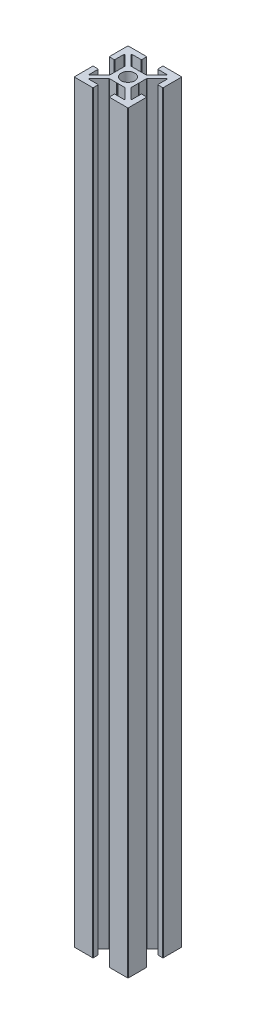
from build123d import *

# Parameters (mm, degrees)
SKETCH1_R           = 2.5
BOSS_EXTRUDE1_DEPTH = 280


with BuildPart() as part:
    # Sketch1 → Boss-Extrude1 (new body)
    with BuildSketch(Plane(origin=(0, 0, 0), x_dir=(1, 0, 0), z_dir=(0, 1, 0))):
        with BuildLine():
            Line((-2.997918472, 4.058578644), (-6.597918472, 7.658578644))
            ThreePointArc((-6.597918472, 7.658578644), (-6.621415508, 7.686854412), (-6.639339828, 7.718953455))
            ThreePointArc((-6.639339828, 7.718953455), (-6.656497116, 7.8), (-6.639339828, 7.881046545))
            ThreePointArc((-6.639339828, 7.881046545), (-6.565562901, 7.967644429), (-6.456497116, 8))
            Line((-6.456497116, 8), (-3.2, 8))
            ThreePointArc((-3.2, 8), (-3.058578644, 8.058578644), (-3, 8.2))
            Line((-3, 8.2), (-3, 9.8))
            ThreePointArc((-3, 9.8), (-3.058578644, 9.941421356), (-3.2, 10))
            Line((-3.2, 10), (-9.8, 10))
            ThreePointArc((-9.8, 10), (-9.941421356, 9.941421356), (-10, 9.8))
            Line((-10, 9.8), (-10, 3.2))
            ThreePointArc((-10, 3.2), (-9.941421356, 3.058578644), (-9.8, 3))
            Line((-9.8, 3), (-8.2, 3))
            ThreePointArc((-8.2, 3), (-8.058578644, 3.058578644), (-8, 3.2))
            Line((-8, 3.2), (-8, 6.456497116))
            ThreePointArc((-8, 6.456497116), (-7.967644429, 6.565562901), (-7.881046545, 6.639339828))
            ThreePointArc((-7.881046545, 6.639339828), (-7.8, 6.656497116), (-7.718953455, 6.639339828))
            ThreePointArc((-7.718953455, 6.639339828), (-7.686854412, 6.621415508), (-7.658578644, 6.597918472))
            Line((-7.658578644, 6.597918472), (-4.058578644, 2.997918472))
            ThreePointArc((-4.058578644, 2.997918472), (-4.015224093, 2.933033802), (-4, 2.856497116))
            Line((-4, 2.856497116), (-4, 0.130901699))
            ThreePointArc((-4, 0.130901699), (-3.99253254, 0.104615144), (-3.97236068, 0.08618034))
            Line((-3.97236068, 0.08618034), (-3.8, 0))
            Line((-3.8, 0), (-3.97236068, -0.08618034))
            ThreePointArc((-3.97236068, -0.08618034), (-3.99253254, -0.104615144), (-4, -0.130901699))
            Line((-4, -0.130901699), (-4, -2.856497116))
            ThreePointArc((-4, -2.856497116), (-4.015224093, -2.933033802), (-4.058578644, -2.997918472))
            Line((-4.058578644, -2.997918472), (-7.658578644, -6.597918472))
            ThreePointArc((-7.658578644, -6.597918472), (-7.686854412, -6.621415508), (-7.718953455, -6.639339828))
            ThreePointArc((-7.718953455, -6.639339828), (-7.8, -6.656497116), (-7.881046545, -6.639339828))
            ThreePointArc((-7.881046545, -6.639339828), (-7.967644429, -6.565562901), (-8, -6.456497116))
            Line((-8, -6.456497116), (-8, -3.2))
            ThreePointArc((-8, -3.2), (-8.058578644, -3.058578644), (-8.2, -3))
            Line((-8.2, -3), (-9.8, -3))
            ThreePointArc((-9.8, -3), (-9.941421356, -3.058578644), (-10, -3.2))
            Line((-10, -3.2), (-10, -9.8))
            ThreePointArc((-10, -9.8), (-9.941421356, -9.941421356), (-9.8, -10))
            Line((-9.8, -10), (-3.2, -10))
            ThreePointArc((-3.2, -10), (-3.058578644, -9.941421356), (-3, -9.8))
            Line((-3, -9.8), (-3, -8.2))
            ThreePointArc((-3, -8.2), (-3.058578644, -8.058578644), (-3.2, -8))
            Line((-3.2, -8), (-6.456497116, -8))
            ThreePointArc((-6.456497116, -8), (-6.565562901, -7.967644429), (-6.639339828, -7.881046545))
            ThreePointArc((-6.639339828, -7.881046545), (-6.656497116, -7.8), (-6.639339828, -7.718953455))
            ThreePointArc((-6.639339828, -7.718953455), (-6.621415508, -7.686854412), (-6.597918472, -7.658578644))
            Line((-6.597918472, -7.658578644), (-2.997918472, -4.058578644))
            ThreePointArc((-2.997918472, -4.058578644), (-2.933033802, -4.015224093), (-2.856497116, -4))
            Line((-2.856497116, -4), (-0.211803399, -4))
            ThreePointArc((-0.211803399, -4), (-0.200315753, -3.998662449), (-0.189442719, -3.99472136))
            Line((-0.189442719, -3.99472136), (0, -3.9))
            Line((0, -3.9), (0.189442719, -3.99472136))
            ThreePointArc((0.189442719, -3.99472136), (0.200315753, -3.998662449), (0.211803399, -4))
            Line((0.211803399, -4), (2.856497116, -4))
            ThreePointArc((2.856497116, -4), (2.933033802, -4.015224093), (2.997918472, -4.058578644))
            Line((2.997918472, -4.058578644), (6.597918472, -7.658578644))
            ThreePointArc((6.597918472, -7.658578644), (6.621415508, -7.686854412), (6.639339828, -7.718953455))
            ThreePointArc((6.639339828, -7.718953455), (6.656497116, -7.8), (6.639339828, -7.881046545))
            ThreePointArc((6.639339828, -7.881046545), (6.565562901, -7.967644429), (6.456497116, -8))
            Line((6.456497116, -8), (3.2, -8))
            ThreePointArc((3.2, -8), (3.058578644, -8.058578644), (3, -8.2))
            Line((3, -8.2), (3, -9.8))
            ThreePointArc((3, -9.8), (3.058578644, -9.941421356), (3.2, -10))
            Line((3.2, -10), (9.8, -10))
            ThreePointArc((9.8, -10), (9.941421356, -9.941421356), (10, -9.8))
            Line((10, -9.8), (10, -3.2))
            ThreePointArc((10, -3.2), (9.941421356, -3.058578644), (9.8, -3))
            Line((9.8, -3), (8.2, -3))
            ThreePointArc((8.2, -3), (8.058578644, -3.058578644), (8, -3.2))
            Line((8, -3.2), (8, -6.456497116))
            ThreePointArc((8, -6.456497116), (7.967644429, -6.565562901), (7.881046545, -6.639339828))
            ThreePointArc((7.881046545, -6.639339828), (7.8, -6.656497116), (7.718953455, -6.639339828))
            ThreePointArc((7.718953455, -6.639339828), (7.686854412, -6.621415508), (7.658578644, -6.597918472))
            Line((7.658578644, -6.597918472), (4.058578644, -2.997918472))
            ThreePointArc((4.058578644, -2.997918472), (4.015224093, -2.933033802), (4, -2.856497116))
            Line((4, -2.856497116), (4, -0.130901699))
            ThreePointArc((4, -0.130901699), (3.99253254, -0.104615144), (3.97236068, -0.08618034))
            Line((3.97236068, -0.08618034), (3.8, 0))
            Line((3.8, 0), (3.97236068, 0.08618034))
            ThreePointArc((3.97236068, 0.08618034), (3.99253254, 0.104615144), (4, 0.130901699))
            Line((4, 0.130901699), (4, 2.856497116))
            ThreePointArc((4, 2.856497116), (4.015224093, 2.933033802), (4.058578644, 2.997918472))
            Line((4.058578644, 2.997918472), (7.658578644, 6.597918472))
            ThreePointArc((7.658578644, 6.597918472), (7.686854412, 6.621415508), (7.718953455, 6.639339828))
            ThreePointArc((7.718953455, 6.639339828), (7.8, 6.656497116), (7.881046545, 6.639339828))
            ThreePointArc((7.881046545, 6.639339828), (7.967644429, 6.565562901), (8, 6.456497116))
            Line((8, 6.456497116), (8, 3.2))
            ThreePointArc((8, 3.2), (8.058578644, 3.058578644), (8.2, 3))
            Line((8.2, 3), (9.8, 3))
            ThreePointArc((9.8, 3), (9.941421356, 3.058578644), (10, 3.2))
            Line((10, 3.2), (10, 9.8))
            ThreePointArc((10, 9.8), (9.941421356, 9.941421356), (9.8, 10))
            Line((9.8, 10), (3.2, 10))
            ThreePointArc((3.2, 10), (3.058578644, 9.941421356), (3, 9.8))
            Line((3, 9.8), (3, 8.2))
            ThreePointArc((3, 8.2), (3.058578644, 8.058578644), (3.2, 8))
            Line((3.2, 8), (6.456497116, 8))
            ThreePointArc((6.456497116, 8), (6.565562901, 7.967644429), (6.639339828, 7.881046545))
            ThreePointArc((6.639339828, 7.881046545), (6.656497116, 7.8), (6.639339828, 7.718953455))
            ThreePointArc((6.639339828, 7.718953455), (6.621415508, 7.686854412), (6.597918472, 7.658578644))
            Line((6.597918472, 7.658578644), (2.997918472, 4.058578644))
            ThreePointArc((2.997918472, 4.058578644), (2.933033802, 4.015224093), (2.856497116, 4))
            Line((2.856497116, 4), (0.211803399, 4))
            ThreePointArc((0.211803399, 4), (0.200315753, 3.998662449), (0.189442719, 3.99472136))
            Line((0.189442719, 3.99472136), (0, 3.9))
            Line((0, 3.9), (-0.189442719, 3.99472136))
            ThreePointArc((-0.189442719, 3.99472136), (-0.200315753, 3.998662449), (-0.211803399, 4))
            Line((-0.211803399, 4), (-2.856497116, 4))
            ThreePointArc((-2.856497116, 4), (-2.933033802, 4.015224093), (-2.997918472, 4.058578644))
        make_face()
        Circle(SKETCH1_R, mode=Mode.SUBTRACT)
    extrude(amount=BOSS_EXTRUDE1_DEPTH)


solid = part.part
